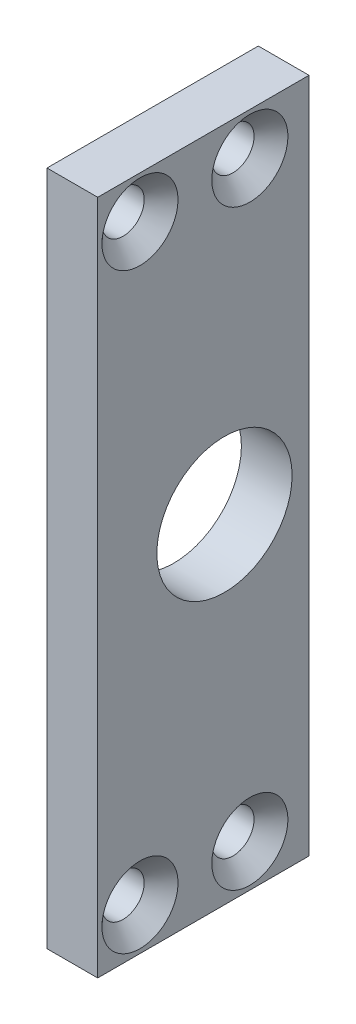
from build123d import *

# Parameters (mm, degrees)
ESQUISSE1_W      = 25
ESQUISSE1_H      = 80
EXTRUSION1_DEPTH = 6
ESQUISSE2_R      = 8
ESQUISSE2_R_2    = 2.5
EXTRUSION2_DEPTH = 85.029756634
CHANFREIN1_SIZE  = 2


with BuildPart() as part:
    # Esquisse1 → Extrusion1 (new body)
    with BuildSketch(Plane(origin=(0, 0, 0), x_dir=(0, 0, -1), z_dir=(1, 0, 0))):
        with Locations((12.5, 40)):
            Rectangle(ESQUISSE1_W, ESQUISSE1_H)
    extrude(amount=EXTRUSION1_DEPTH)

    # Esquisse2 → Extrusion2 (cut, through all)
    with BuildSketch(Plane(origin=(6, 0, 0), x_dir=(0, 0, -1), z_dir=(1, 0, 0))):
        with Locations((15, 40)):
            Circle(ESQUISSE2_R)
        with Locations((5, 5)):
            Circle(ESQUISSE2_R_2)
        with Locations((18, 5)):
            Circle(ESQUISSE2_R_2)
        with Locations((5, 75)):
            Circle(ESQUISSE2_R_2)
        with Locations((18, 75)):
            Circle(ESQUISSE2_R_2)
    extrude(amount=-EXTRUSION2_DEPTH, mode=Mode.SUBTRACT)

    # Chanfrein1
    chanfrein1_edges = [part.edges().sort_by_distance(p)[0] for p in [
        (6, 5, -2.5),
        (6, 5, -15.5),
        (6, 75, -2.5),
        (6, 75, -15.5),
    ]]
    chamfer(chanfrein1_edges, length=CHANFREIN1_SIZE)


solid = part.part
